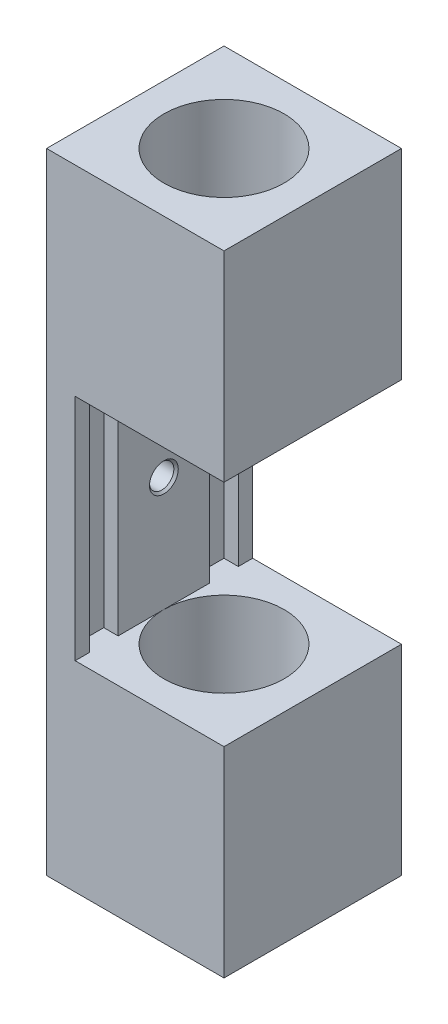
from build123d import *

# Parameters (mm, degrees)
SKETCH_2_W                    = 62
SKETCH_2_H                    = 62
SKETCH_2_R                    = 21
EXTRUDE_2_DEPTH               = 220
SKETCH_4_R                    = 21
SKETCH_4_R_2                  = 3.5
EXTRUDE_3_DEPTH               = 5
CUT_EXTRUDE_1_DEPTH           = 40
HOLE_WIZARD_M10_1_D           = 8.5
HOLE_WIZARD_M10_1_CSINK_D     = 10.05
HOLE_WIZARD_M10_1_CSINK_ANGLE = 90
SKETCH_7_W                    = 10
SKETCH_7_H                    = 80
CUT_EXTRUDE_2_DEPTH           = 5
SKETCH_10_W                   = 10
SKETCH_10_H                   = 80
CUT_EXTRUDE_3_DEPTH           = 5


with BuildPart() as part:
    # 草图2 → 凸台-拉伸2 (new body)
    with BuildSketch(Plane(origin=(0, 0, 0), x_dir=(1, 0, 0), z_dir=(0, 1, 0))):
        Rectangle(SKETCH_2_W, SKETCH_2_H)
        with Locations(Location((0, 0, 0), (0, 0, 270))):
            Circle(SKETCH_2_R, mode=Mode.SUBTRACT)
    extrude(amount=EXTRUDE_2_DEPTH)

    # 草图4 → 凸台-拉伸3 (add)
    with BuildSketch(Plane.XZ):
        with Locations(Location((0, 0, 0), (0, 0, 270))):
            Circle(SKETCH_4_R)
        with Locations(Location((0, 0, 0), (0, 0, 270))):
            Circle(SKETCH_4_R_2, mode=Mode.SUBTRACT)
    extrude(amount=-EXTRUDE_3_DEPTH)

    # 草图3 → 切除-拉伸1 (cut, symmetric)
    with BuildSketch(Plane(origin=(0, 110, 0), x_dir=(1, 0, 0), z_dir=(0, 1, 0))):
        Polygon((-21, 0), (-21, 36.73556218), (47.200279586, 36.73556218), (47.200279586, -37.147800903), (-21, -37.147800903), align=None)
    extrude(amount=CUT_EXTRUDE_1_DEPTH, both=True, mode=Mode.SUBTRACT)

    # M10 螺纹孔1 (through all)
    with Locations(Plane(origin=(-21, 110, 0), x_dir=(0, 0, 1), z_dir=(1, 0, 0))):
        with Locations((0, 0)):
            CounterSinkHole(HOLE_WIZARD_M10_1_D / 2, HOLE_WIZARD_M10_1_CSINK_D / 2, counter_sink_angle=HOLE_WIZARD_M10_1_CSINK_ANGLE)

    # 草图7 → 切除-拉伸2 (cut)
    with BuildSketch(Plane(origin=(-21, 0, 0), x_dir=(0, 0, -1), z_dir=(1, 0, 0))):
        with Locations((21, 110)):
            Rectangle(SKETCH_7_W, SKETCH_7_H)
    extrude(amount=-CUT_EXTRUDE_2_DEPTH, mode=Mode.SUBTRACT)

    # 草图10 → 切除-拉伸3 (cut)
    with BuildSketch(Plane(origin=(-21, 0, 0), x_dir=(0, 0, -1), z_dir=(1, 0, 0))):
        with Locations((-21, 110)):
            Rectangle(SKETCH_10_W, SKETCH_10_H)
    extrude(amount=-CUT_EXTRUDE_3_DEPTH, mode=Mode.SUBTRACT)


solid = part.part
